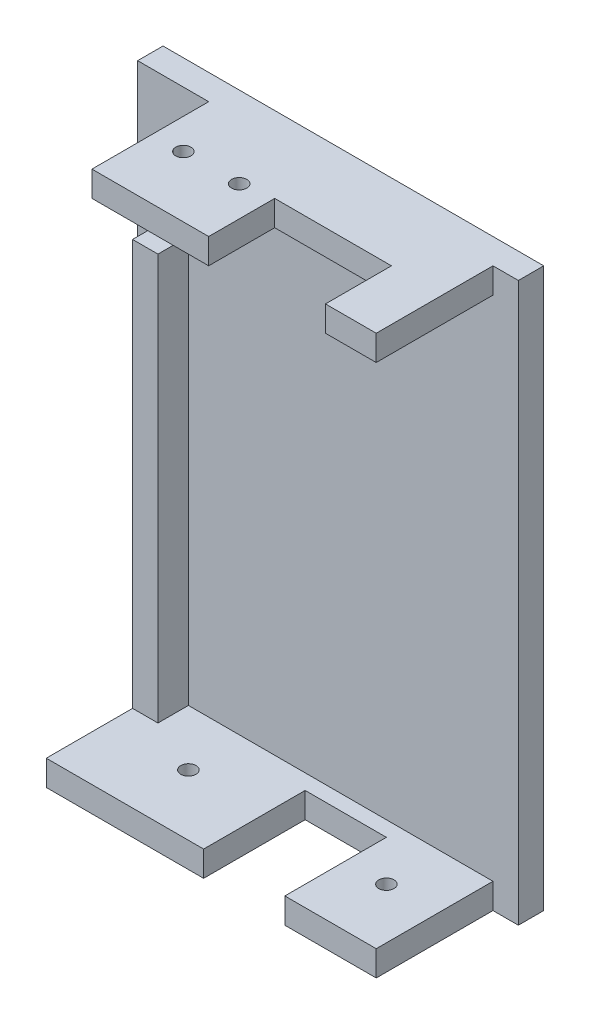
from build123d import *

# Parameters (mm, degrees)
SKETCH_1_W          = 75
SKETCH_1_H          = 110
EXTRUDE_1_DEPTH     = 5
SKETCH_2_W          = 65
SKETCH_2_H          = 5
SKETCH_2_W_2        = 56
EXTRUDE_2_DEPTH     = 23
SKETCH_3_R          = 1.5
SKETCH_3_W          = 23
SKETCH_3_H          = 13
CUT_EXTRUDE_1_DEPTH = 10
CUT_EXTRUDE_2_REACH = 120.34
SKETCH_5_W          = 16
SKETCH_5_H          = 20
CUT_EXTRUDE_3_REACH = 120.34
SKETCH_6_R          = 1.5
CUT_EXTRUDE_4_REACH = 124.798
SKETCH_7_R          = 1.5
SKETCH_8_W          = 5
SKETCH_8_H          = 80
EXTRUDE_3_DEPTH     = 6


with BuildPart() as part:
    # 草圖1 → 填料-伸長1 (new body)
    with BuildSketch(Plane.XY):
        with Locations((9.355675066, -19.631766382)):
            Rectangle(SKETCH_1_W, SKETCH_1_H)
    extrude(amount=EXTRUDE_1_DEPTH)

    # 草圖2 → 填料-伸長2 (add)
    with BuildSketch(Plane.XY.offset(5)):
        with Locations((9.355675066, -72.131766382)):
            Rectangle(SKETCH_2_W, SKETCH_2_H)
        with Locations((13.855675066, 32.868233618)):
            Rectangle(SKETCH_2_W_2, SKETCH_2_H)
    extrude(amount=EXTRUDE_2_DEPTH)

    # 草圖3 → 除料-伸長1 (cut)
    with BuildSketch(Plane(origin=(0, 35.368233618, 0), x_dir=(1, 0, 0), z_dir=(0, 1, 0))):
        with Locations(Location((2.855675066, -16, 0), (0, 0, 270))):
            Circle(SKETCH_3_R)
        with Locations(Location((-8.144324934, -16, 0), (0, 0, 270))):
            Circle(SKETCH_3_R)
        with Locations((20.355675066, -21.5)):
            Rectangle(SKETCH_3_W, SKETCH_3_H)
    extrude(amount=-CUT_EXTRUDE_1_DEPTH, mode=Mode.SUBTRACT)

    # 草圖5 → 除料-伸長2 (cut, up to next)
    with BuildSketch(Plane(origin=(0, -69.631766382, 0), x_dir=(1, 0, 0), z_dir=(0, 1, 0)), mode=Mode.PRIVATE) as cut_extrude_2_sk1:
        with Locations((15.855675066, -18)):
            Rectangle(SKETCH_5_W, SKETCH_5_H)
    cut_extrude_2_tool1 = extrude(cut_extrude_2_sk1.sketch, amount=-CUT_EXTRUDE_2_REACH, mode=Mode.PRIVATE) & part.part
    add(cut_extrude_2_tool1.solids().sort_by_distance((15.855675, -69.631766, 18))[0], mode=Mode.SUBTRACT)

    # 草圖6 → 除料-伸長3 (cut, up to next)
    with BuildSketch(Plane(origin=(0, -69.631766382, 0), x_dir=(1, 0, 0), z_dir=(0, 1, 0)), mode=Mode.PRIVATE) as cut_extrude_3_sk1:
        with Locations(Location((31.855675066, -16, 0), (0, 0, 270))):
            Circle(SKETCH_6_R)
    cut_extrude_3_tool1 = extrude(cut_extrude_3_sk1.sketch, amount=-CUT_EXTRUDE_3_REACH, mode=Mode.PRIVATE) & part.part
    add(cut_extrude_3_tool1.solids().sort_by_distance((31.855675, -69.631766, 16))[0], mode=Mode.SUBTRACT)

    # 草圖7 → 除料-伸長4 (cut, up to next)
    with BuildSketch(Plane.XZ.offset(74.631766382), mode=Mode.PRIVATE) as cut_extrude_4_sk1:
        with Locations(Location((-7.144324934, 16, 0), (0, 0, 270))):
            Circle(SKETCH_7_R)
    cut_extrude_4_tool1 = extrude(cut_extrude_4_sk1.sketch, amount=-CUT_EXTRUDE_4_REACH, mode=Mode.PRIVATE) & part.part
    add(cut_extrude_4_tool1.solids().sort_by_distance((-7.144325, -74.631766, 16))[0], mode=Mode.SUBTRACT)

    # 草圖8 → 填料-伸長3 (add)
    with BuildSketch(Plane.XY.offset(5)):
        with Locations((-20.644324934, -29.631766382)):
            Rectangle(SKETCH_8_W, SKETCH_8_H)
    extrude(amount=EXTRUDE_3_DEPTH)


solid = part.part
